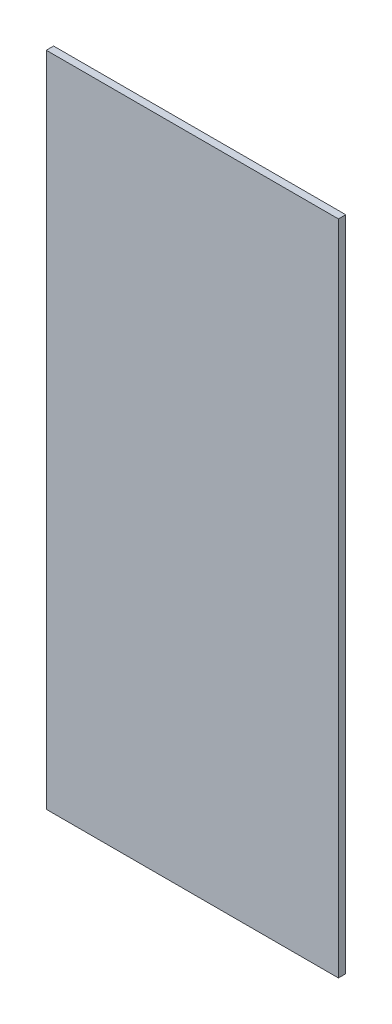
from build123d import *

# Parameters (mm, degrees)
SKETCH1_W           = 101.6
SKETCH1_H           = 228.6
BOSS_EXTRUDE1_DEPTH = 2.54


with BuildPart() as part:
    # Sketch1 → Boss-Extrude1 (new body)
    with BuildSketch(Plane.XY):
        with Locations((50.8, 114.3)):
            Rectangle(SKETCH1_W, SKETCH1_H)
    extrude(amount=BOSS_EXTRUDE1_DEPTH)


solid = part.part
